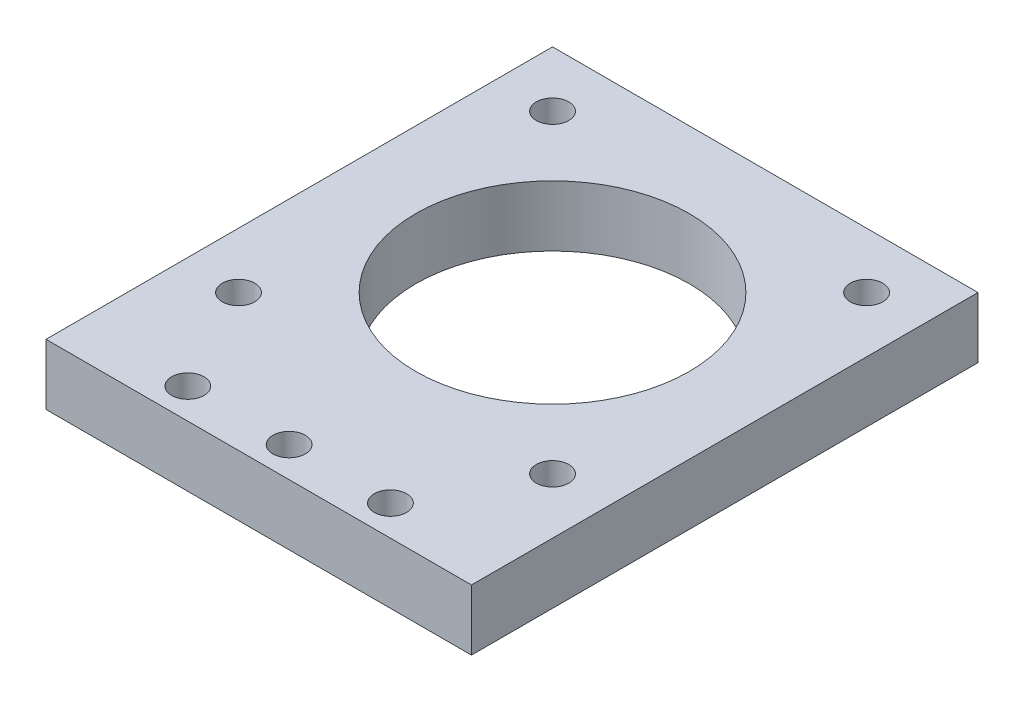
from build123d import *

# Parameters (mm, degrees)
SKETCH_1_W      = 42
SKETCH_1_H      = 50
SKETCH_1_R      = 13.5
SKETCH_1_R_2    = 1.6
EXTRUDE_1_DEPTH = 6


with BuildPart() as part:
    # 草图1 → 凸台-拉伸1 (new body)
    with BuildSketch(Plane(origin=(0, 0, 0), x_dir=(1, 0, 0), z_dir=(0, 1, 0))):
        with Locations((21, 25)):
            Rectangle(SKETCH_1_W, SKETCH_1_H)
        with Locations(Location((21, 29, 0), (0, 0, 270))):
            Circle(SKETCH_1_R, mode=Mode.SUBTRACT)
        with Locations(Location((11, 3, 0), (0, 0, 270))):
            Circle(SKETCH_1_R_2, mode=Mode.SUBTRACT)
        with Locations(Location((31, 3, 0), (0, 0, 270))):
            Circle(SKETCH_1_R_2, mode=Mode.SUBTRACT)
        with Locations(Location((36.5, 44.5, 0), (0, 0, 270))):
            Circle(SKETCH_1_R_2, mode=Mode.SUBTRACT)
        with Locations(Location((5.5, 44.5, 0), (0, 0, 270))):
            Circle(SKETCH_1_R_2, mode=Mode.SUBTRACT)
        with Locations(Location((21, 3, 0), (0, 0, 270))):
            Circle(SKETCH_1_R_2, mode=Mode.SUBTRACT)
        with Locations(Location((36.5, 13.5, 0), (0, 0, 270))):
            Circle(SKETCH_1_R_2, mode=Mode.SUBTRACT)
        with Locations(Location((5.5, 13.5, 0), (0, 0, 270))):
            Circle(SKETCH_1_R_2, mode=Mode.SUBTRACT)
    extrude(amount=EXTRUDE_1_DEPTH)


solid = part.part
